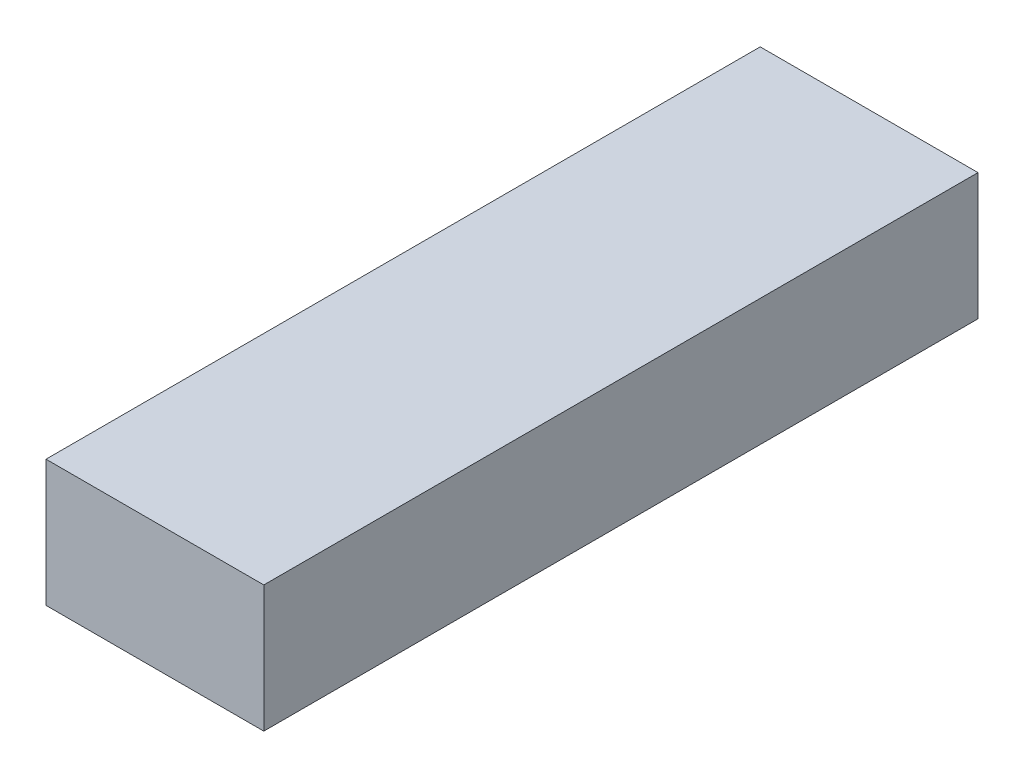
from build123d import *

# Parameters (mm, degrees)
SKETCH1_W           = 43
SKETCH1_H           = 25
BOSS_EXTRUDE1_DEPTH = 141


with BuildPart() as part:
    # Sketch1 → Boss-Extrude1 (new body)
    with BuildSketch(Plane.XY):
        Rectangle(SKETCH1_W, SKETCH1_H)
    extrude(amount=BOSS_EXTRUDE1_DEPTH)


solid = part.part
